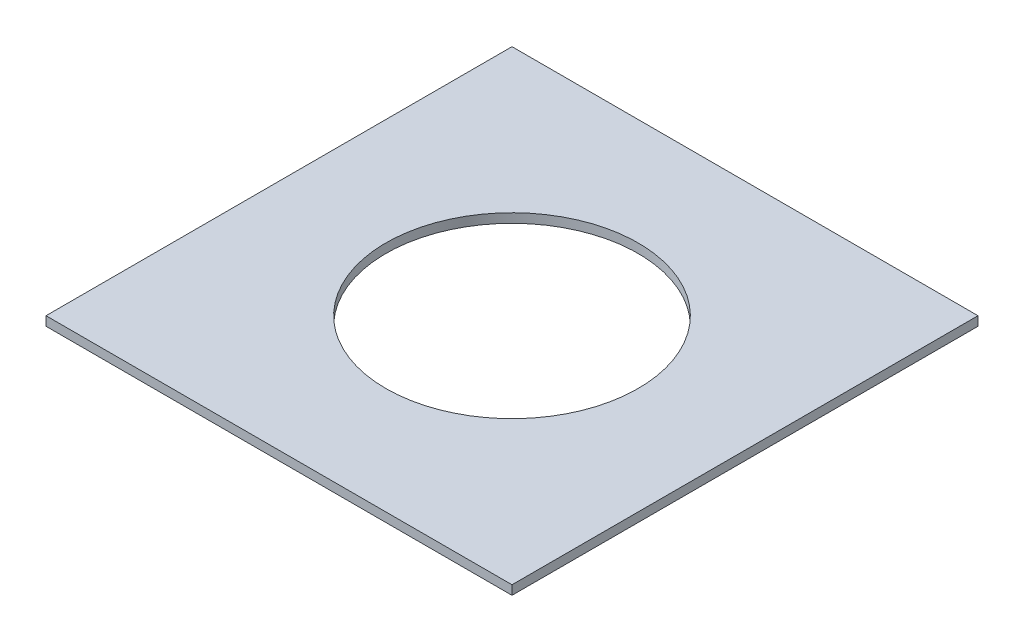
from build123d import *

# Parameters (mm, degrees)
SKETCH1_W           = 101.6
SKETCH1_H           = 101.6
SKETCH1_R           = 27.5
BOSS_EXTRUDE1_DEPTH = 2


with BuildPart() as part:
    # Sketch1 → Boss-Extrude1 (new body)
    with BuildSketch(Plane(origin=(0, 0, 0), x_dir=(1, 0, 0), z_dir=(0, 1, 0))):
        Rectangle(SKETCH1_W, SKETCH1_H)
        with Locations(Location((0, 0, 0), (0, 0, 270))):
            Circle(SKETCH1_R, mode=Mode.SUBTRACT)
    extrude(amount=BOSS_EXTRUDE1_DEPTH)


solid = part.part
